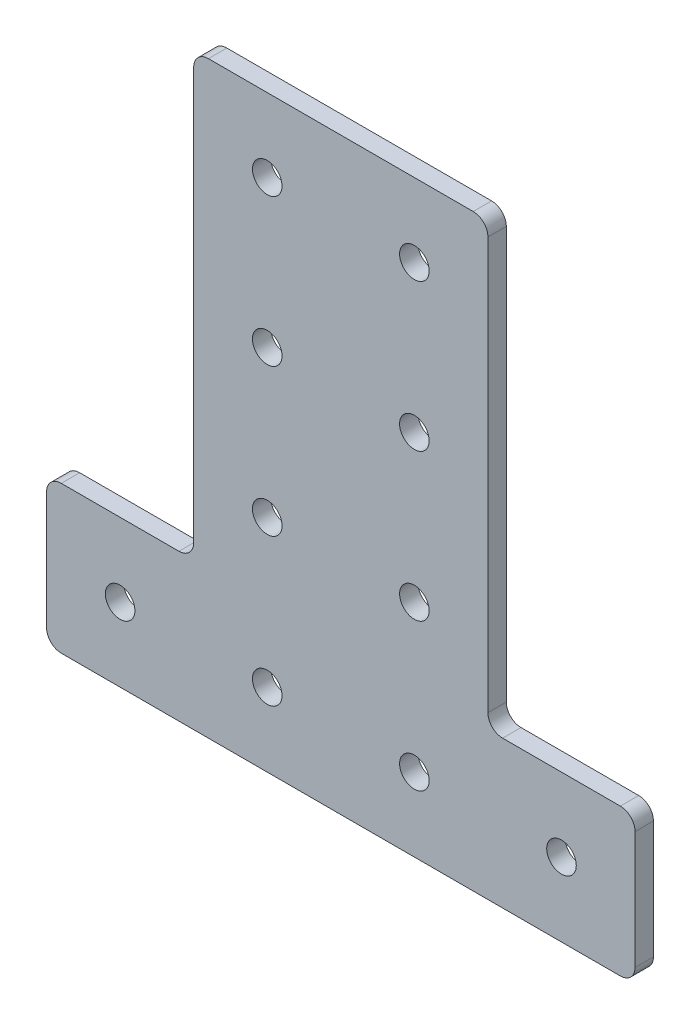
from build123d import *

# Parameters (mm, degrees)
BOSS_EXTRUDE1_DEPTH    = 3.175
FILLET1_R              = 2.54
F_10_CLEARANCE_HOLE1_D = 5.1054
F_10_CLEARANCE_HOLE2_D = 5.1054


with BuildPart() as part:
    # Sketch1 → Boss-Extrude1 (new body)
    with BuildSketch(Plane.XY):
        Polygon((-76.2, 25.4), (-101.6, 25.4), (-101.6, 0), (0, 0), (0, 25.4), (-25.4, 25.4), (-25.4, 101.6), (-76.2, 101.6), align=None)
    extrude(amount=BOSS_EXTRUDE1_DEPTH)

    # Fillet1
    fillet1_edges = [part.edges().sort_by_distance(p)[0] for p in [
        (0, 0, 1.5875),
        (-101.6, 0, 1.5875),
        (-101.6, 25.4, 1.5875),
        (-76.2, 25.4, 1.5875),
        (-76.2, 101.6, 1.5875),
        (-25.4, 101.6, 1.5875),
        (-25.4, 25.4, 1.5875),
        (0, 25.4, 1.5875),
    ]]
    fillet(fillet1_edges, radius=FILLET1_R)

    # #10 Clearance Hole1 (through all)
    with Locations(Plane.XY.offset(3.175)):
        with Locations((-63.5, 88.9), (-63.5, 63.5), (-63.5, 38.1), (-38.1, 88.9), (-38.1, 63.5), (-38.1, 38.1)):
            Hole(F_10_CLEARANCE_HOLE1_D / 2)

    # #10 Clearance Hole2 (through all)
    with Locations(Plane(origin=(0, 0, 0), x_dir=(1, 0, 0), z_dir=(0, 0, -1))):
        with Locations((-88.9, -12.7), (-63.5, -12.7), (-38.1, -12.7), (-12.7, -12.7)):
            Hole(F_10_CLEARANCE_HOLE2_D / 2)


solid = part.part
